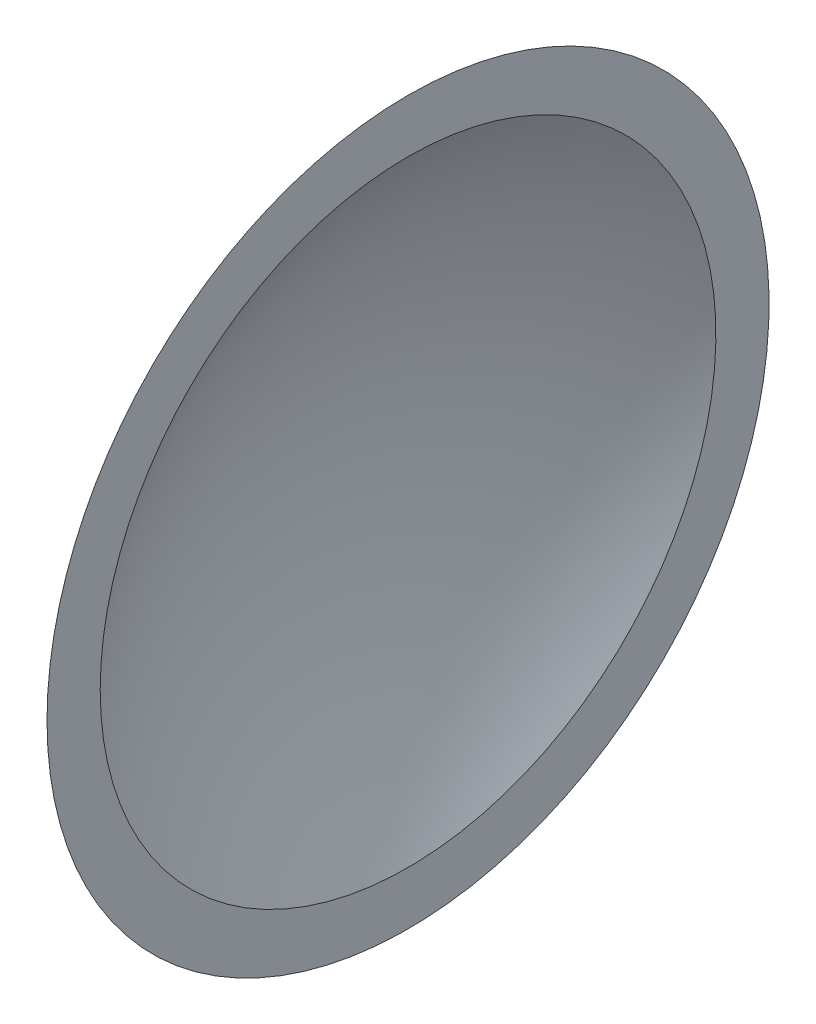
from build123d import *


with BuildPart() as part:
    # Sketch1 → Revolve1 (revolve)
    with BuildSketch(Plane.XY):
        with BuildLine():
            ThreePointArc((-4.263306591, 3.063774944), (-4.99724222, 1.609369503), (-5.25, 0))
            Line((-5.25, 0), (-5, 0))
            ThreePointArc((-5, 0), (-4.812303656, 1.357104831), (-4.263306591, 2.612320215))
            Line((-4.263306591, 2.612320215), (-4.263306591, 3.063774944))
        make_face()
    revolve(axis=Axis((-5, 0, 0), (1, 0, 0)))


solid = part.part
